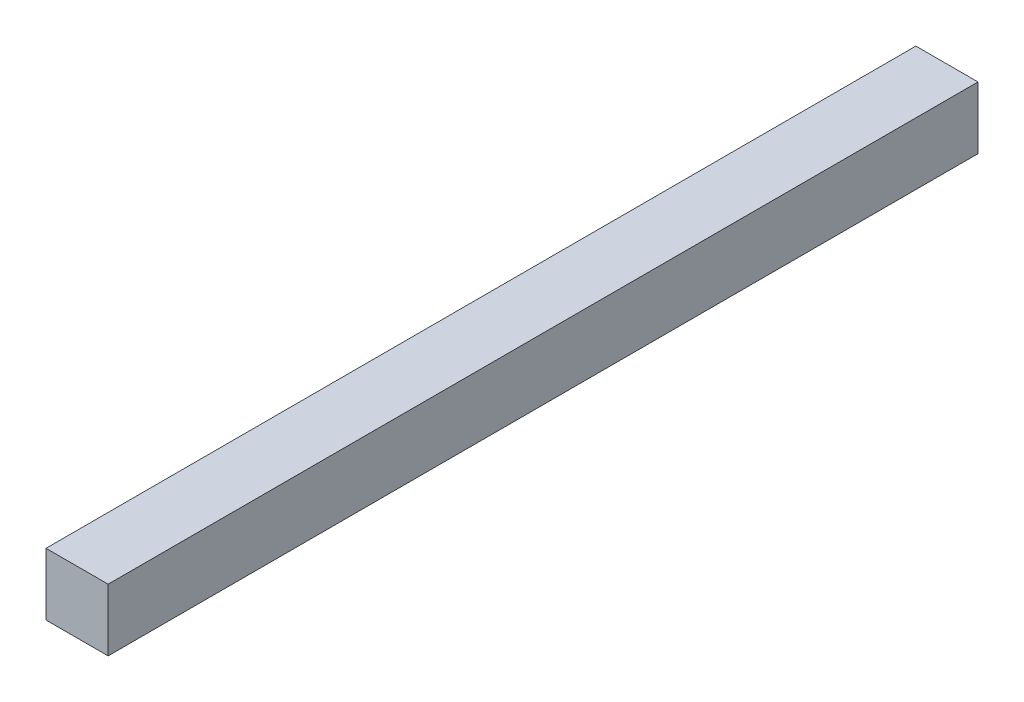
from build123d import *

# Parameters (mm, degrees)
SKICA1_W                = 0.8
SKICA1_H                = 0.8
P_IDAT_VYSUNUT_M1_DEPTH = 11.2


with BuildPart() as part:
    # Skica1 → Přidat vysunutím1 (new body)
    with BuildSketch(Plane.XY):
        with Locations((0.4, 0.4)):
            Rectangle(SKICA1_W, SKICA1_H)
    extrude(amount=P_IDAT_VYSUNUT_M1_DEPTH)


solid = part.part
